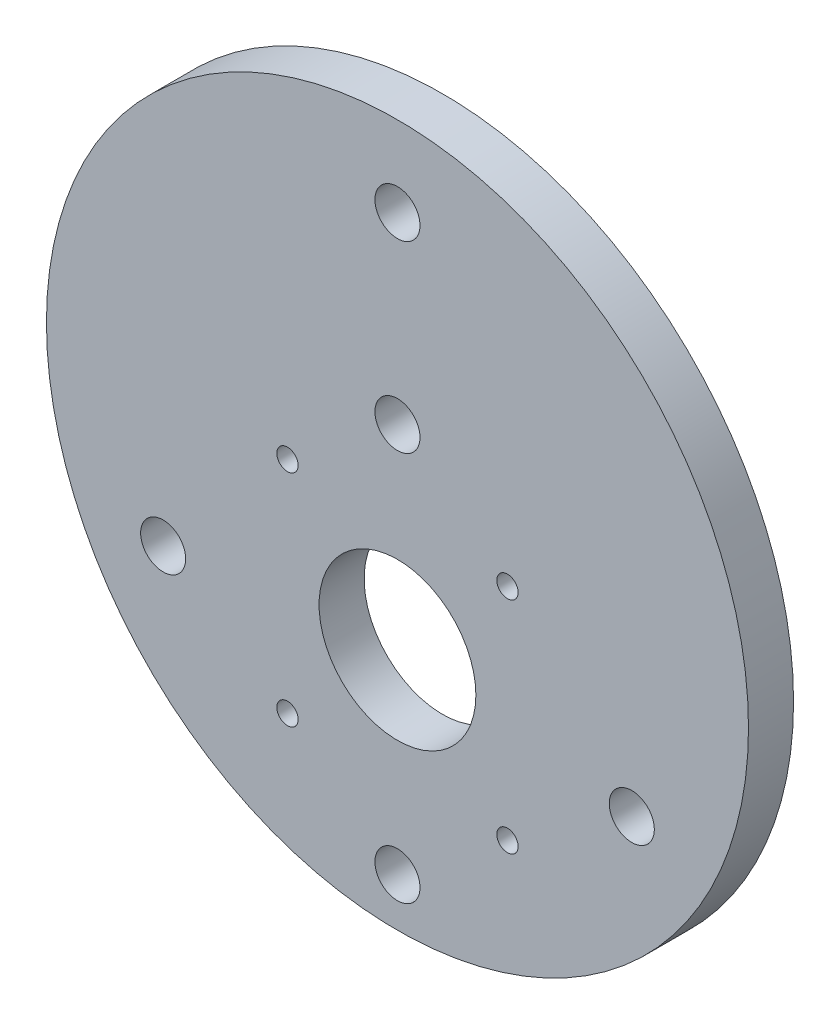
from build123d import *

# Parameters (mm, degrees)
SKETCH1_R             = 49.4665
BOSS_EXTRUDE1_DEPTH   = 6.35
F_3_0MM_DOWEL_HOLE1_D = 3
SKETCH5_R             = 3.175
CUT_EXTRUDE1_DEPTH    = 71.243802179
SKETCH6_R             = 3.175
CUT_EXTRUDE2_DEPTH    = 71.243802179
SKETCH7_R             = 11.049
CUT_EXTRUDE3_DEPTH    = 71.243802179


with BuildPart() as part:
    # Sketch1 → Boss-Extrude1 (new body)
    with BuildSketch(Plane.XY):
        Circle(SKETCH1_R)
    extrude(amount=BOSS_EXTRUDE1_DEPTH)

    # Ø3.0mm Dowel Hole1 (through all)
    with Locations(Plane.XY.offset(6.35)):
        with Locations((15.5, 0.26), (-15.5, 0.26), (-15.5, -30.74), (15.5, -30.74)):
            Hole(F_3_0MM_DOWEL_HOLE1_D / 2)

    # Sketch5 → Cut-Extrude1 (cut, through all)
    with BuildSketch(Plane.XY.offset(6.35)):
        with Locations((0, -42.672)):
            Circle(SKETCH5_R)
        with Locations((0, 12.26)):
            Circle(SKETCH5_R)
    extrude(amount=-CUT_EXTRUDE1_DEPTH, mode=Mode.SUBTRACT)

    # Sketch6 → Cut-Extrude2 (cut, through all)
    with BuildSketch(Plane.XY.offset(6.35)):
        with Locations((0, 38.128211777)):
            Circle(SKETCH6_R)
        with Locations((-33.02, -19.064105889)):
            Circle(SKETCH6_R)
        with Locations((33.02, -19.064105889)):
            Circle(SKETCH6_R)
    extrude(amount=-CUT_EXTRUDE2_DEPTH, mode=Mode.SUBTRACT)

    # Sketch7 → Cut-Extrude3 (cut, through all)
    with BuildSketch(Plane.XY.offset(6.35)):
        with Locations((0, -15.24)):
            Circle(SKETCH7_R)
    extrude(amount=-CUT_EXTRUDE3_DEPTH, mode=Mode.SUBTRACT)


solid = part.part
